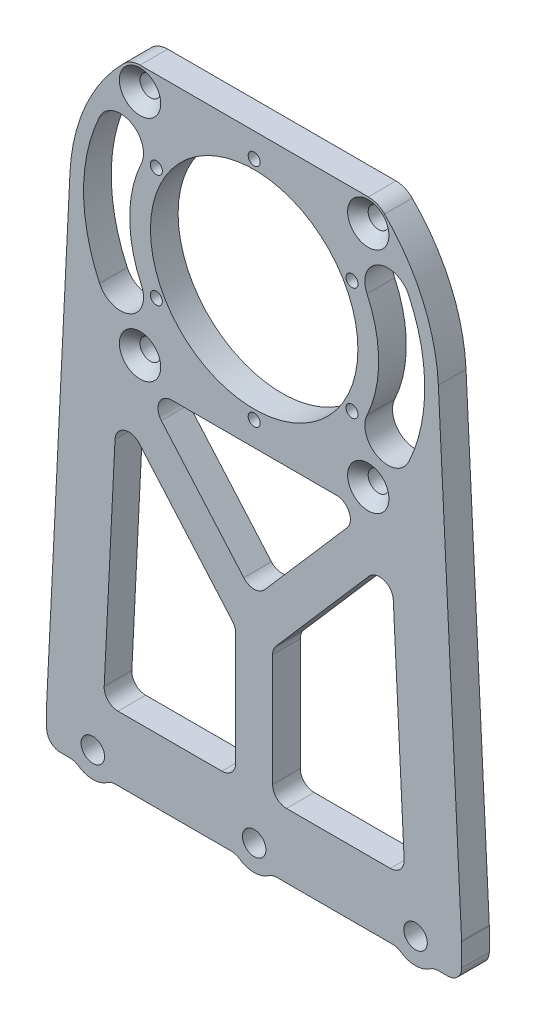
from build123d import *

# Parameters (mm, degrees)
SKETCH_1_W                   = 90
SKETCH_1_H                   = 8
SKETCH_1_R                   = 2.1
SKETCH_1_R_2                 = 1.3
SKETCH_1_R_3                 = 22.5
EXTRUDE_1_DEPTH              = 6
HOLE_WIZARD_M4_1_D           = 4.5
HOLE_WIZARD_M4_1_DEPTH       = 11.4
HOLE_WIZARD_M4_1_CSINK_D     = 8.96
HOLE_WIZARD_M4_1_CSINK_ANGLE = 90
HOLE_WIZARD_M4_1_TIP         = 1.351936393
SKETCH_4_R                   = 2.55
CUT_EXTRUDE_1_DEPTH          = 148.17676447
EXTRUDE_2_DEPTH              = 6
CUT_EXTRUDE_3_DEPTH          = 148.17676447
FILLET_1_R                   = 5
FILLET_2_R                   = 3
FILLET_4_R                   = 3
CUT_EXTRUDE_4_DEPTH          = 138.461757743


with BuildPart() as part:
    # 草图1 → 凸台-拉伸1 (new body)
    # profile 1 of 3: a face of its own
    with BuildSketch(Plane.XY):
        with BuildLine():
            Line((-39.951065042, 101.977979269), (-45, 0))
            Line((-45, 0), (45, 0))
            Line((45, 0), (39.951065042, 101.977979269))
            ThreePointArc((39.951065042, 101.977979269), (39.987764389, 100.989292249), (40, 100))
            ThreePointArc((40, 100), (-0.989292249, 60.012235611), (-39.951065042, 101.977979269))
        make_face()
    # profile 2 of 3: a face of its own
    with BuildSketch(Plane.XY):
        with Locations((0, -4)):
            Rectangle(SKETCH_1_W, SKETCH_1_H)
    # profile 3 of 3: a face of its own
    with BuildSketch(Plane.XY):
        with BuildLine():
            ThreePointArc((39.951065042, 101.977979269), (0, 140), (-39.951065042, 101.977979269))
            ThreePointArc((-39.951065042, 101.977979269), (-0.989292249, 60.012235611), (40, 100))
            ThreePointArc((40, 100), (39.987764389, 100.989292249), (39.951065042, 101.977979269))
        make_face()
        with Locations((-24.748737342, 75.251262658)):
            Circle(SKETCH_1_R, mode=Mode.SUBTRACT)
        with Locations((-21.217622393, 87.75)):
            Circle(SKETCH_1_R_2, mode=Mode.SUBTRACT)
        with Locations((-24.748737342, 124.748737342)):
            Circle(SKETCH_1_R, mode=Mode.SUBTRACT)
        with Locations((-21.217622393, 112.25)):
            Circle(SKETCH_1_R_2, mode=Mode.SUBTRACT)
        with Locations((0, 75.5)):
            Circle(SKETCH_1_R_2, mode=Mode.SUBTRACT)
        with Locations((0, 100)):
            Circle(SKETCH_1_R_3, mode=Mode.SUBTRACT)
        with Locations((21.217622393, 87.75)):
            Circle(SKETCH_1_R_2, mode=Mode.SUBTRACT)
        with Locations((24.748737342, 75.251262658)):
            Circle(SKETCH_1_R, mode=Mode.SUBTRACT)
        with Locations((21.217622393, 112.25)):
            Circle(SKETCH_1_R_2, mode=Mode.SUBTRACT)
        with Locations((0, 124.5)):
            Circle(SKETCH_1_R_2, mode=Mode.SUBTRACT)
        with Locations((24.748737342, 124.748737342)):
            Circle(SKETCH_1_R, mode=Mode.SUBTRACT)
    extrude(amount=EXTRUDE_1_DEPTH)

    # M4 六角凹锥坑螺钉的锥形沉头孔1
    with Locations(Plane.XY.offset(6)):
        with Locations((-24.748737342, 124.748737342), (24.748737342, 124.748737342), (24.748737342, 75.251262658), (-24.748737342, 75.251262658)):
            CounterSinkHole(HOLE_WIZARD_M4_1_D / 2, HOLE_WIZARD_M4_1_CSINK_D / 2, depth=HOLE_WIZARD_M4_1_DEPTH, counter_sink_angle=HOLE_WIZARD_M4_1_CSINK_ANGLE)
            with Locations((0, 0, -(HOLE_WIZARD_M4_1_DEPTH + HOLE_WIZARD_M4_1_TIP / 2))):  # 118° drill point
                Cone(0, HOLE_WIZARD_M4_1_D / 2, HOLE_WIZARD_M4_1_TIP, mode=Mode.SUBTRACT)

    # 草图4 → 切除-拉伸1 (cut, through all)
    with BuildSketch(Plane.XY.offset(6)):
        with Locations((-35, -4)):
            Circle(SKETCH_4_R)
        with Locations((0, -4)):
            Circle(SKETCH_4_R)
        with Locations((35, -4)):
            Circle(SKETCH_4_R)
    extrude(amount=-CUT_EXTRUDE_1_DEPTH, mode=Mode.SUBTRACT)

    # 草图5 → 凸台-拉伸2 (add)
    with BuildSketch(Plane.XY.offset(6)):
        with BuildLine():
            ThreePointArc((-38.847401721, -8), (-35, -9.55), (-31.152598279, -8))
            Line((-31.152598279, -8), (-38.847401721, -8))
        make_face()
        with BuildLine():
            ThreePointArc((-3.847401721, -8), (0, -9.55), (3.847401721, -8))
            Line((3.847401721, -8), (-3.847401721, -8))
        make_face()
        with BuildLine():
            ThreePointArc((31.152598279, -8), (35, -9.55), (38.847401721, -8))
            Line((38.847401721, -8), (31.152598279, -8))
        make_face()
    extrude(amount=-EXTRUDE_2_DEPTH)

    # 草图6 → 切除-拉伸3 (cut, through all)
    with BuildSketch(Plane.XY.offset(6)):
        with BuildLine():
            ThreePointArc((26.739720017, 129.748737342), (0, 140), (-26.739720017, 129.748737342))
            Line((-26.739720017, 129.748737342), (26.739720017, 129.748737342))
        make_face()
        Polygon((32.688241225, 6), (29.805909331, 64.217106098), (4, 34.505425616), (4, 6), align=None)
        Polygon((-4, 34.505425616), (-29.805909331, 64.217106098), (-32.688241225, 6), (-4, 6), align=None)
        Polygon((24.450633349, 70.251262658), (-24.450633349, 70.251262658), (0, 42.099981634), align=None)
    extrude(amount=-CUT_EXTRUDE_3_DEPTH, mode=Mode.SUBTRACT)

    # 圆角1
    fillet_1_edges = [part.edges().sort_by_distance(p)[0] for p in [
        (-26.739720017, 129.748737342, 3),
        (26.739720017, 129.748737342, 3),
    ]]
    fillet(fillet_1_edges, radius=FILLET_1_R)

    # 圆角2
    fillet_2_edges = [part.edges().sort_by_distance(p)[0] for p in [
        (24.450633349, 70.251262658, 3),
        (0, 42.099981634, 3),
        (-24.450633349, 70.251262658, 3),
        (-4, 34.505425616, 3),
        (-4, 6, 3),
        (-32.688241225, 6, 3),
        (-29.805909331, 64.217106098, 3),
        (4, 34.505425616, 3),
        (29.805909331, 64.217106098, 3),
        (32.688241225, 6, 3),
        (4, 6, 3),
    ]]
    fillet(fillet_2_edges, radius=FILLET_2_R)

    # 圆角4
    fillet_4_edges = [part.edges().sort_by_distance(p)[0] for p in [
        (-38.847401721, -8, 3),
        (-31.152598279, -8, 3),
        (-3.847401721, -8, 3),
        (3.847401721, -8, 3),
        (31.152598279, -8, 3),
        (38.847401721, -8, 3),
        (45, 0, 3),
        (45, -8, 3),
        (-45, -8, 3),
        (-45, 0, 3),
    ]]
    fillet(fillet_4_edges, radius=FILLET_4_R)

    # 草图7 → 切除-拉伸4 (cut, through all)
    with BuildSketch(Plane.XY.offset(6)):
        with BuildLine():
            ThreePointArc((33.53338812, 84.363124316), (37, 100), (33.53338812, 115.636875684))
            ThreePointArc((33.53338812, 115.636875684), (26.888757876, 118.055323311), (24.47031025, 111.410693067))
            ThreePointArc((24.47031025, 111.410693067), (27, 100), (24.47031025, 88.589306933))
            ThreePointArc((24.47031025, 88.589306933), (26.888757876, 81.944676689), (33.53338812, 84.363124316))
        make_face()
        with BuildLine():
            ThreePointArc((-33.53338812, 84.363124316), (-37, 100), (-33.53338812, 115.636875684))
            ThreePointArc((-33.53338812, 115.636875684), (-26.888757876, 118.055323311), (-24.47031025, 111.410693067))
            ThreePointArc((-24.47031025, 111.410693067), (-27, 100), (-24.47031025, 88.589306933))
            ThreePointArc((-24.47031025, 88.589306933), (-26.888757876, 81.944676689), (-33.53338812, 84.363124316))
        make_face()
    extrude(amount=-CUT_EXTRUDE_4_DEPTH, mode=Mode.SUBTRACT)


solid = part.part
